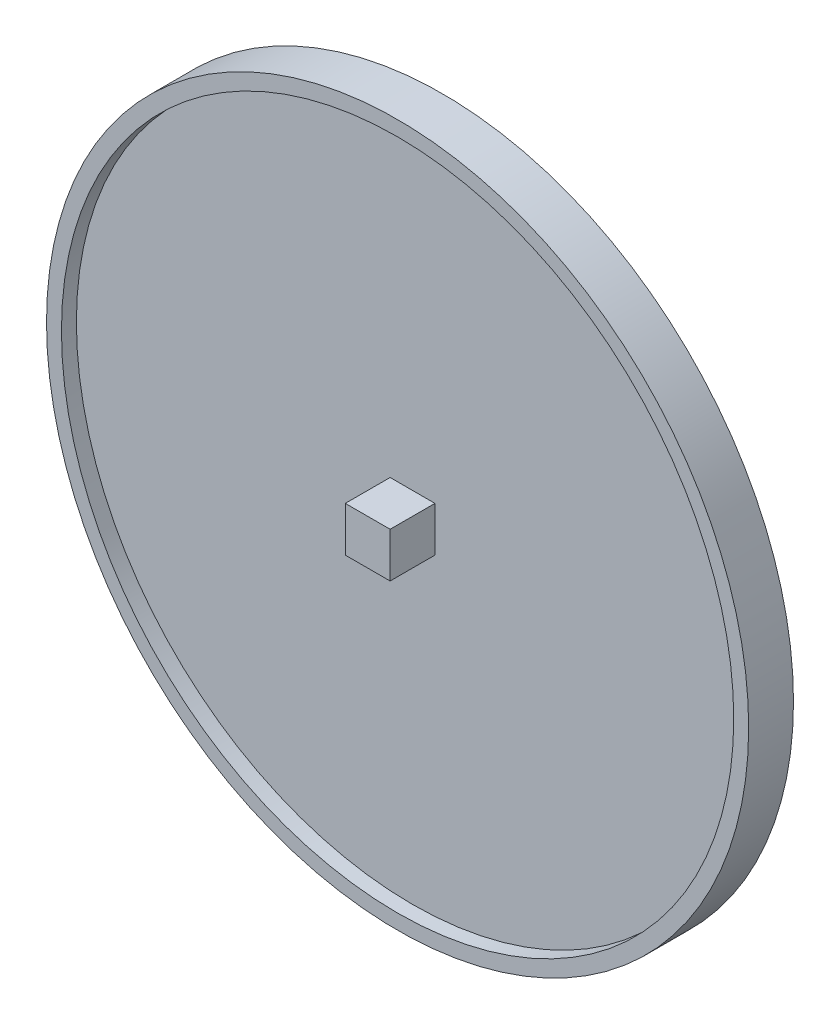
from build123d import *

# Parameters (mm, degrees)
SCHIZZO1_R                   = 235
ESTRUSIONE_ESTRUSIONE1_DEPTH = 20
SCHIZZO2_R                   = 235
SCHIZZO2_R_2                 = 225
ESTRUSIONE_ESTRUSIONE2_DEPTH = 10
SCHIZZO3_W                   = 30
SCHIZZO3_H                   = 30
ESTRUSIONE_ESTRUSIONE3_DEPTH = 30


with BuildPart() as part:
    # Schizzo1 → Estrusione-Estrusione1 (new body)
    with BuildSketch(Plane.XY):
        Circle(SCHIZZO1_R)
    extrude(amount=ESTRUSIONE_ESTRUSIONE1_DEPTH)

    # Schizzo2 → Estrusione-Estrusione2 (add)
    with BuildSketch(Plane.XY.offset(20)):
        Circle(SCHIZZO2_R)
        Circle(SCHIZZO2_R_2, mode=Mode.SUBTRACT)
    extrude(amount=ESTRUSIONE_ESTRUSIONE2_DEPTH)

    # Schizzo3 → Estrusione-Estrusione3 (add)
    with BuildSketch(Plane.XY.offset(20)):
        Rectangle(SCHIZZO3_W, SCHIZZO3_H)
    extrude(amount=ESTRUSIONE_ESTRUSIONE3_DEPTH)


solid = part.part
